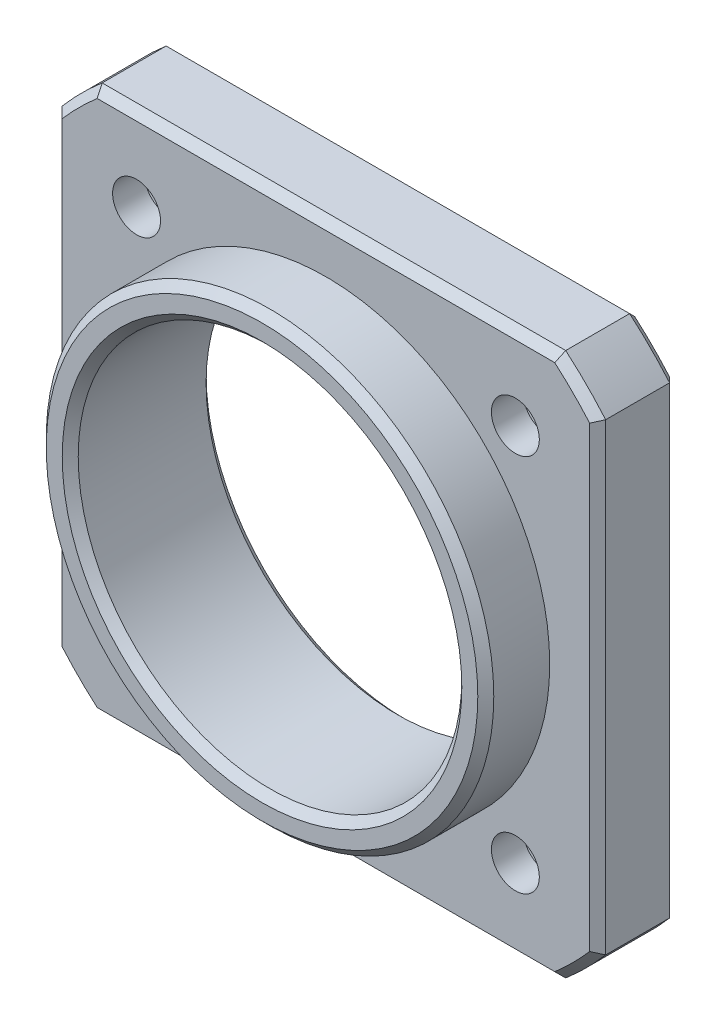
from build123d import *

# Parameters (mm, degrees)
SKETCH1_R           = 1.5
SKETCH1_R_2         = 12
BOSS_EXTRUDE1_DEPTH = 9
CUT_EXTRUDE1_START  = -4
SKETCH2_R           = 14
CUT_EXTRUDE1_DEPTH  = 4
SKETCH3_R           = 4
CUT_EXTRUDE2_DEPTH  = 3
CHAMFER1_SIZE       = 0.5
CHAMFER2_SIZE       = 0.5


with BuildPart() as part:
    # Sketch1 → Boss-Extrude1 (new body)
    with BuildSketch(Plane.XY):
        with BuildLine():
            Line((-14.5, 17), (14.5, 17))
            ThreePointArc((14.5, 17), (15.799525309, 15.799525309), (17, 14.5))
            Line((17, 14.5), (17, -14.5))
            ThreePointArc((17, -14.5), (15.799525309, -15.799525309), (14.5, -17))
            Line((14.5, -17), (-14.5, -17))
            ThreePointArc((-14.5, -17), (-15.799525309, -15.799525309), (-17, -14.5))
            Line((-17, -14.5), (-17, 14.5))
            ThreePointArc((-17, 14.5), (-15.799525309, 15.799525309), (-14.5, 17))
        make_face()
        with Locations((-11.85, 11.85)):
            Circle(SKETCH1_R, mode=Mode.SUBTRACT)
        with Locations(Location((11.85, 11.85, 0), (0, 0, 180))):
            Circle(SKETCH1_R, mode=Mode.SUBTRACT)
        with Locations((11.85, -11.85)):
            Circle(SKETCH1_R, mode=Mode.SUBTRACT)
        with Locations(Location((-11.85, -11.85, 0), (0, 0, 180))):
            Circle(SKETCH1_R, mode=Mode.SUBTRACT)
        Circle(SKETCH1_R_2, mode=Mode.SUBTRACT)
    extrude(amount=BOSS_EXTRUDE1_DEPTH)

    # Sketch2 → Cut-Extrude1 (cut)
    with BuildSketch(Plane.XY.offset(9).offset(CUT_EXTRUDE1_START)):
        with BuildLine():
            Line((-14.5, 17), (14.5, 17))
            ThreePointArc((14.5, 17), (15.799525309, 15.799525309), (17, 14.5))
            Line((17, 14.5), (17, -14.5))
            ThreePointArc((17, -14.5), (15.799525309, -15.799525309), (14.5, -17))
            Line((14.5, -17), (-14.5, -17))
            ThreePointArc((-14.5, -17), (-15.799525309, -15.799525309), (-17, -14.5))
            Line((-17, -14.5), (-17, 14.5))
            ThreePointArc((-17, 14.5), (-15.799525309, 15.799525309), (-14.5, 17))
        make_face()
        Circle(SKETCH2_R, mode=Mode.SUBTRACT)
    extrude(amount=CUT_EXTRUDE1_DEPTH, mode=Mode.SUBTRACT)

    # Sketch3 → Cut-Extrude2 (cut)
    with BuildSketch(Plane(origin=(0, 0, 0), x_dir=(-1, 0, 0), z_dir=(0, 0, -1))):
        with Locations((-11.85, 11.85)):
            Circle(SKETCH3_R)
        with Locations(Location((11.85, 11.85, 0), (0, 0, 180))):
            Circle(SKETCH3_R)
        with Locations((11.85, -11.85)):
            Circle(SKETCH3_R)
        with Locations(Location((-11.85, -11.85, 0), (0, 0, 180))):
            Circle(SKETCH3_R)
    extrude(amount=-CUT_EXTRUDE2_DEPTH, mode=Mode.SUBTRACT)

    # Chamfer1
    chamfer1_edges = [part.edges().sort_by_distance(p)[0] for p in [
        (-17, 0, 0),
        (-15.799525309, 15.799525309, 0),
        (-15.799525309, 15.799525309, 5),
        (0, 17, 5),
        (15.799525309, 15.799525309, 5),
        (17, 0, 5),
        (15.799525309, -15.799525309, 5),
        (0, -17, 5),
        (-15.799525309, -15.799525309, 5),
        (-17, 0, 5),
        (0, 17, 0),
        (15.799525309, 15.799525309, 0),
        (17, 0, 0),
        (15.799525309, -15.799525309, 0),
        (0, -17, 0),
        (-15.799525309, -15.799525309, 0),
    ]]
    chamfer(chamfer1_edges, length=CHAMFER1_SIZE)

    # Chamfer2
    chamfer2_edges = [part.edges().sort_by_distance(p)[0] for p in [
        (-12, 0, 0),
        (-12, 0, 9),
        (-14, 0, 9),
    ]]
    chamfer(chamfer2_edges, length=CHAMFER2_SIZE)


solid = part.part
